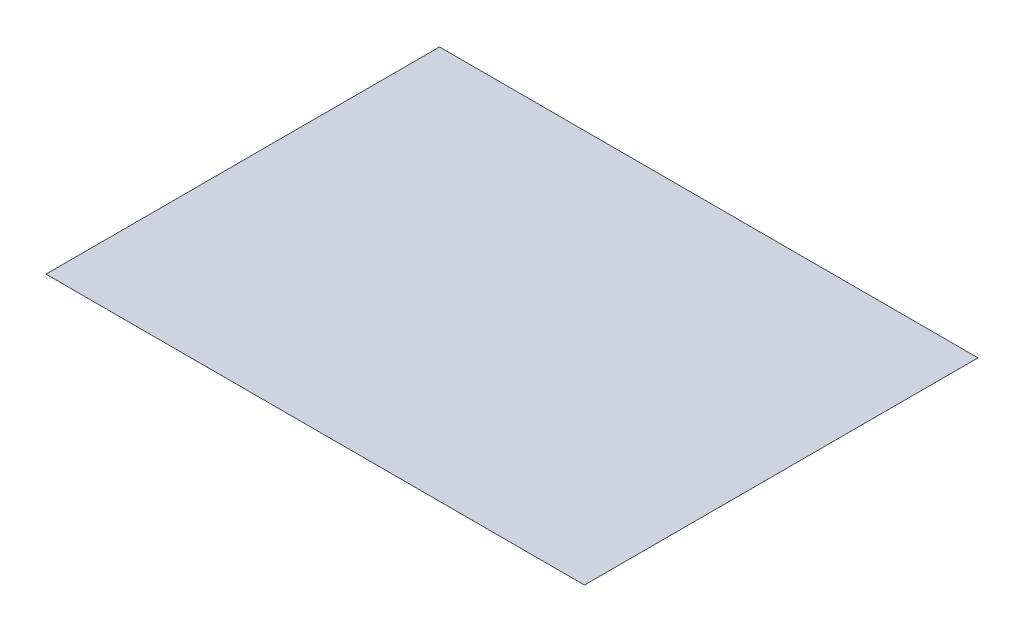
from build123d import *

# Parameters (mm, degrees)
SKETCH1_W           = 130
SKETCH1_H           = 95
BOSS_EXTRUDE1_DEPTH = 0.005


with BuildPart() as part:
    # Sketch1 → Boss-Extrude1 (new body)
    with BuildSketch(Plane(origin=(0, 0, 0), x_dir=(1, 0, 0), z_dir=(0, 1, 0))):
        Rectangle(SKETCH1_W, SKETCH1_H)
    extrude(amount=BOSS_EXTRUDE1_DEPTH)


solid = part.part
